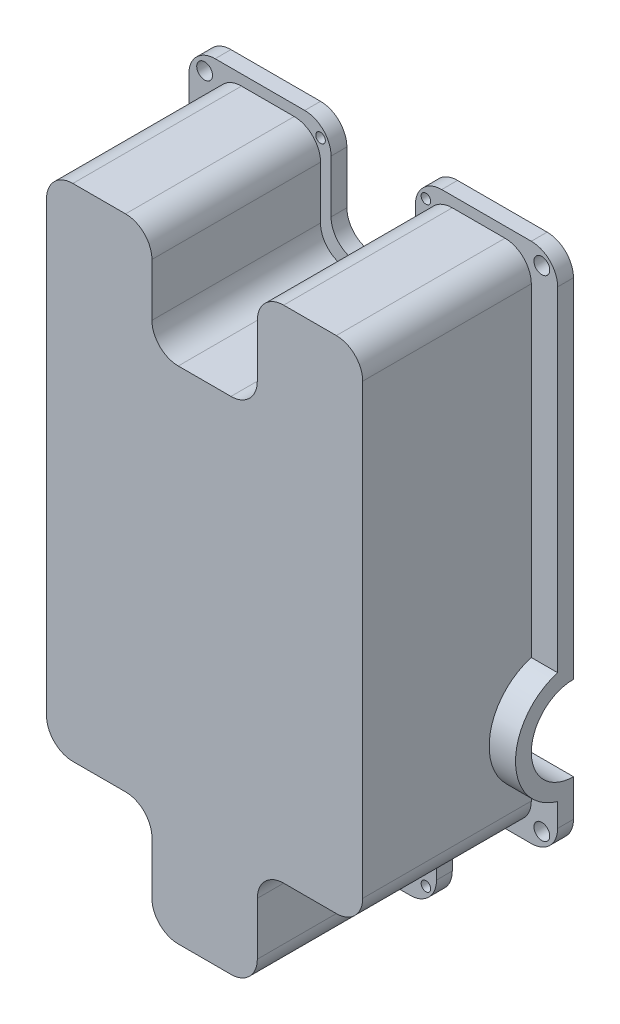
from build123d import *

# Parameters (mm, degrees)
SKETCH1_W           = 70
SKETCH1_H           = 119
BOSS_EXTRUDE1_DEPTH = 35
SKETCH2_R           = 8
CUT_EXTRUDE1_DEPTH  = 8
CUT_EXTRUDE2_DEPTH  = 32
SKETCH4_R           = 7.5
CUT_EXTRUDE3_DEPTH  = 8
SKETCH5_W           = 16
SKETCH5_H           = 20
SKETCH5_W_2         = 23
CUT_EXTRUDE4_DEPTH  = 78.396705356
CUT_EXTRUDE5_DEPTH  = 5
SKETCH7_W           = 18
SKETCH7_H           = 32
CUT_EXTRUDE6_DEPTH  = 2
SKETCH8_W           = 32
SKETCH8_H           = 22
CUT_EXTRUDE7_DEPTH  = 2
SKETCH9_W           = 22
SKETCH9_H           = 32
CUT_EXTRUDE8_DEPTH  = 2
SKETCH10_W          = 32
SKETCH10_H          = 18
CUT_EXTRUDE9_DEPTH  = 2
SKETCH11_W          = 25
SKETCH11_H          = 32
CUT_EXTRUDE10_DEPTH = 2
CUT_EXTRUDE11_DEPTH = 5
SKETCH13_W          = 22
SKETCH13_H          = 32
CUT_EXTRUDE12_DEPTH = 2
SKETCH14_W          = 32
SKETCH14_H          = 18
CUT_EXTRUDE13_DEPTH = 2
SKETCH15_W          = 18
SKETCH15_H          = 32
CUT_EXTRUDE14_DEPTH = 2
SKETCH16_W          = 32
SKETCH16_H          = 22
CUT_EXTRUDE15_DEPTH = 2
SKETCH17_W          = 20
SKETCH17_H          = 32
CUT_EXTRUDE16_DEPTH = 2
FILLET1_R           = 5
FILLET2_R           = 5
FILLET3_R           = 5
SKETCH18_R          = 1.5
CUT_EXTRUDE17_DEPTH = 10
SKETCH19_R          = 0.91
CUT_EXTRUDE18_DEPTH = 10
BOSS_EXTRUDE2_START = -6
BOSS_EXTRUDE2_DEPTH = 6
BOSS_EXTRUDE3_DEPTH = 6


with BuildPart() as part:
    # Sketch1 → Boss-Extrude1 (new body)
    with BuildSketch(Plane.XY):
        Rectangle(SKETCH1_W, SKETCH1_H)
    extrude(amount=BOSS_EXTRUDE1_DEPTH)

    # Sketch2 → Cut-Extrude1 (cut)
    with BuildSketch(Plane(origin=(35, 0, 0), x_dir=(0, 0, -1), z_dir=(1, 0, 0))):
        with Locations((0, -19.5)):
            Circle(SKETCH2_R)
    extrude(amount=-CUT_EXTRUDE1_DEPTH, mode=Mode.SUBTRACT)

    # Sketch3 → Cut-Extrude2 (cut)
    with BuildSketch(Plane(origin=(0, 0, 0), x_dir=(-1, 0, 0), z_dir=(0, 0, -1))):
        Polygon((-27, 54.5), (-13, 54.5), (-13, 27), (-7, 27), (-7, 34.5), (7, 34.5), (7, -12), (13, -12), (13, 54.5), (27, 54.5), (27, -34.5), (13, -34.5), (13, -27), (7, -27), (7, -54.5), (-7, -54.5), (-7, 12), (-13, 12), (-13, -34.5), (-27, -34.5), align=None)
    extrude(amount=-CUT_EXTRUDE2_DEPTH, mode=Mode.SUBTRACT)

    # Sketch4 → Cut-Extrude3 (cut)
    with BuildSketch(Plane.ZY.offset(35)):
        with Locations((0, 19.5)):
            Circle(SKETCH4_R)
    extrude(amount=-CUT_EXTRUDE3_DEPTH, mode=Mode.SUBTRACT)

    # Sketch5 → Cut-Extrude4 (cut, through all)
    with BuildSketch(Plane(origin=(0, 0, 0), x_dir=(-1, 0, 0), z_dir=(0, 0, -1))):
        with Locations((0, 49.5)):
            Rectangle(SKETCH5_W, SKETCH5_H)
        with Locations((-23.5, -49.5)):
            Rectangle(SKETCH5_W_2, SKETCH5_H)
        with Locations((23.5, -49.5)):
            Rectangle(SKETCH5_W_2, SKETCH5_H)
    extrude(amount=-CUT_EXTRUDE4_DEPTH, mode=Mode.SUBTRACT)

    # Sketch6 → Cut-Extrude5 (cut)
    with BuildSketch(Plane(origin=(35, 0, 0), x_dir=(0, 0, -1), z_dir=(1, 0, 0))):
        with BuildLine():
            Line((-3, 59.5), (-35, 59.5))
            Line((-35, 59.5), (-35, -39.5))
            Line((-35, -39.5), (-3, -39.5))
            Line((-3, -39.5), (-3, -30.083005244))
            ThreePointArc((-3, -30.083005244), (-11, -19.5), (-3, -8.916994756))
            Line((-3, -8.916994756), (-3, 59.5))
        make_face()
    extrude(amount=-CUT_EXTRUDE5_DEPTH, mode=Mode.SUBTRACT)

    # Sketch7 → Cut-Extrude6 (cut)
    with BuildSketch(Plane.XZ.offset(39.5)):
        with Locations((21, 19)):
            Rectangle(SKETCH7_W, SKETCH7_H)
    extrude(amount=-CUT_EXTRUDE6_DEPTH, mode=Mode.SUBTRACT)

    # Sketch8 → Cut-Extrude7 (cut)
    with BuildSketch(Plane(origin=(12, 0, 0), x_dir=(0, 0, -1), z_dir=(1, 0, 0))):
        with Locations((-19, -48.5)):
            Rectangle(SKETCH8_W, SKETCH8_H)
    extrude(amount=-CUT_EXTRUDE7_DEPTH, mode=Mode.SUBTRACT)

    # Sketch9 → Cut-Extrude8 (cut)
    with BuildSketch(Plane.XZ.offset(59.5)):
        with Locations((-1, 19)):
            Rectangle(SKETCH9_W, SKETCH9_H)
    extrude(amount=-CUT_EXTRUDE8_DEPTH, mode=Mode.SUBTRACT)

    # Sketch10 → Cut-Extrude9 (cut)
    with BuildSketch(Plane.ZY.offset(12)):
        with Locations((19, -48.5)):
            Rectangle(SKETCH10_W, SKETCH10_H)
    extrude(amount=-CUT_EXTRUDE9_DEPTH, mode=Mode.SUBTRACT)

    # Sketch11 → Cut-Extrude10 (cut)
    with BuildSketch(Plane.XZ.offset(39.5)):
        with Locations((-22.5, 19)):
            Rectangle(SKETCH11_W, SKETCH11_H)
    extrude(amount=-CUT_EXTRUDE10_DEPTH, mode=Mode.SUBTRACT)

    # Sketch12 → Cut-Extrude11 (cut)
    with BuildSketch(Plane.ZY.offset(35)):
        with BuildLine():
            Line((3, 59.5), (35, 59.5))
            Line((35, 59.5), (35, -37.5))
            Line((35, -37.5), (3, -37.5))
            Line((3, -37.5), (3, 9.437694101))
            ThreePointArc((3, 9.437694101), (10.5, 19.5), (3, 29.562305899))
            Line((3, 29.562305899), (3, 59.5))
        make_face()
    extrude(amount=-CUT_EXTRUDE11_DEPTH, mode=Mode.SUBTRACT)

    # Sketch13 → Cut-Extrude12 (cut)
    with BuildSketch(Plane(origin=(0, 59.5, 0), x_dir=(1, 0, 0), z_dir=(0, 1, 0))):
        with Locations((-19, -19)):
            Rectangle(SKETCH13_W, SKETCH13_H)
    extrude(amount=-CUT_EXTRUDE12_DEPTH, mode=Mode.SUBTRACT)

    # Sketch14 → Cut-Extrude13 (cut)
    with BuildSketch(Plane(origin=(-8, 0, 0), x_dir=(0, 0, -1), z_dir=(1, 0, 0))):
        with Locations((-19, 48.5)):
            Rectangle(SKETCH14_W, SKETCH14_H)
    extrude(amount=-CUT_EXTRUDE13_DEPTH, mode=Mode.SUBTRACT)

    # Sketch15 → Cut-Extrude14 (cut)
    with BuildSketch(Plane(origin=(0, 39.5, 0), x_dir=(1, 0, 0), z_dir=(0, 1, 0))):
        with Locations((-1, -19)):
            Rectangle(SKETCH15_W, SKETCH15_H)
    extrude(amount=-CUT_EXTRUDE14_DEPTH, mode=Mode.SUBTRACT)

    # Sketch16 → Cut-Extrude15 (cut)
    with BuildSketch(Plane.ZY.offset(-8)):
        with Locations((19, 48.5)):
            Rectangle(SKETCH16_W, SKETCH16_H)
    extrude(amount=-CUT_EXTRUDE15_DEPTH, mode=Mode.SUBTRACT)

    # Sketch17 → Cut-Extrude16 (cut)
    with BuildSketch(Plane(origin=(0, 59.5, 0), x_dir=(1, 0, 0), z_dir=(0, 1, 0))):
        with Locations((20, -19)):
            Rectangle(SKETCH17_W, SKETCH17_H)
    extrude(amount=-CUT_EXTRUDE16_DEPTH, mode=Mode.SUBTRACT)

    # Fillet1
    fillet1_edges = [part.edges().sort_by_distance(p)[0] for p in [
        (27, -34.5, 16),
        (27, 54.5, 16),
        (13, 54.5, 16),
        (7, 34.5, 16),
        (-7, 34.5, 16),
        (-13, 54.5, 16),
        (-27, 54.5, 16),
        (-27, -34.5, 16),
        (-13, -34.5, 16),
        (-7, -54.5, 16),
        (7, -54.5, 16),
        (13, -34.5, 16),
    ]]
    fillet(fillet1_edges, radius=FILLET1_R)

    # Fillet2
    fillet2_edges = [part.edges().sort_by_distance(p)[0] for p in [
        (30, -37.5, 19),
        (10, -37.5, 19),
        (10, -57.5, 19),
        (-10, -57.5, 19),
        (-10, -37.5, 19),
        (-30, -37.5, 19),
        (-30, 57.5, 19),
        (-10, 57.5, 19),
        (-10, 37.5, 19),
        (10, 37.5, 19),
        (10, 57.5, 19),
        (30, 57.5, 19),
    ]]
    fillet(fillet2_edges, radius=FILLET2_R)

    # Fillet3
    fillet3_edges = [part.edges().sort_by_distance(p)[0] for p in [
        (35, -39.5, 1.5),
        (35, 59.5, 1.5),
        (12, -39.5, 1.5),
        (12, -59.5, 1.5),
        (-12, -59.5, 1.5),
        (-12, -39.5, 1.5),
        (-35, -39.5, 1.5),
        (-35, 59.5, 1.5),
        (-8, 59.5, 1.5),
        (-8, 39.5, 1.5),
        (8, 39.5, 1.5),
        (8, 59.5, 1.5),
    ]]
    fillet(fillet3_edges, radius=FILLET3_R)

    # Sketch18 → Cut-Extrude17 (cut)
    with BuildSketch(Plane(origin=(0, 0, 0), x_dir=(-1, 0, 0), z_dir=(0, 0, -1))):
        with Locations((-32, 56.5)):
            Circle(SKETCH18_R)
        with Locations((32, 56.5)):
            Circle(SKETCH18_R)
        with Locations((-32, -36.5)):
            Circle(SKETCH18_R)
        with Locations((32, -36.5)):
            Circle(SKETCH18_R)
        with Locations((10, -36.5)):
            Circle(SKETCH18_R)
        with Locations((-10, -36.5)):
            Circle(SKETCH18_R)
    extrude(amount=-CUT_EXTRUDE17_DEPTH, mode=Mode.SUBTRACT)

    # Sketch19 → Cut-Extrude18 (cut)
    with BuildSketch(Plane(origin=(0, 0, 0), x_dir=(-1, 0, 0), z_dir=(0, 0, -1))):
        with Locations((-10, 56.5)):
            Circle(SKETCH19_R)
        with Locations((10, 56.5)):
            Circle(SKETCH19_R)
        with Locations((10, -56.5)):
            Circle(SKETCH19_R)
        with Locations((-10, -56.5)):
            Circle(SKETCH19_R)
    extrude(amount=-CUT_EXTRUDE18_DEPTH, mode=Mode.SUBTRACT)

    # Sketch20 → Boss-Extrude2 (add)
    with BuildSketch(Plane(origin=(13, 0, 0), x_dir=(0, 0, -1), z_dir=(1, 0, 0)).offset(BOSS_EXTRUDE2_START)):
        with BuildLine():
            Line((0, 27), (-32, 27))
            Line((-32, 27), (-32, 12))
            Line((-32, 12), (0, 12))
            ThreePointArc((0, 12), (-7.5, 19.5), (0, 27))
        make_face()
    extrude(amount=BOSS_EXTRUDE2_DEPTH)

    # Sketch21 → Boss-Extrude3 (add)
    with BuildSketch(Plane(origin=(-7, 0, 0), x_dir=(0, 0, -1), z_dir=(1, 0, 0))):
        with BuildLine():
            Line((0, -12), (-32, -12))
            Line((-32, -12), (-32, -27))
            Line((-32, -27), (0, -27))
            ThreePointArc((0, -27), (-7.5, -19.5), (0, -12))
        make_face()
    extrude(amount=-BOSS_EXTRUDE3_DEPTH)


solid = part.part
